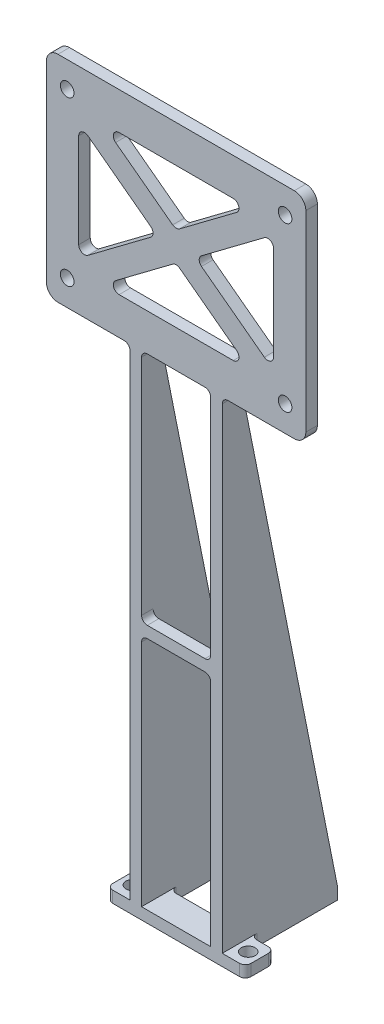
from build123d import *

# Parameters (mm, degrees)
BOSS_EXTRUDE1_DEPTH      = 2.54
CUT_EXTRUDE1_DEPTH       = 2.54
CUT_EXTRUDE3_START       = -2.54
SKETCH4_W                = 57.139047114
SKETCH4_H                = 47.329047114
CUT_EXTRUDE3_DEPTH       = 2.54
FILLET5_R                = 1.27
FILLET6_R                = 1.27
FILLET7_R                = 2.54
BOSS_EXTRUDE2_DEPTH      = 10.16
BOSS_EXTRUDE2_DEPTH_BACK = 10.16
SKETCH7_W                = 15.24
SKETCH7_H                = 106.095476443
CUT_EXTRUDE4_DEPTH       = 52.324
SKETCH8_W                = 15.24
SKETCH8_H                = 12.7
SKETCH8_R                = 1.524
BOSS_EXTRUDE3_DEPTH      = 2.54
SKETCH10_W               = 14.001226512
SKETCH10_H               = 1.640904711
CUT_EXTRUDE5_DEPTH       = 12.192
FILLET9_R                = 1.27
FILLET10_R               = 1.27
SKETCH11_W               = 15.296857303
SKETCH11_H               = 2.54
BOSS_EXTRUDE4_DEPTH      = 2.54
FILLET12_R               = 1.27


with BuildPart() as part:
    # Sketch1 → Boss-Extrude1 (new body)
    with BuildSketch(Plane(origin=(0, 0, 0), x_dir=(-1, 0, 0), z_dir=(0, 0, 1))):
        with BuildLine():
            Line((-27.900000003, -31.869047114), (27.899999998, -31.869047114))
            ThreePointArc((27.899999998, -31.869047114), (30.70654013, -30.706540129), (31.869047114, -27.899999998))
            Line((31.869047114, -27.899999998), (31.869047114, 27.899999996))
            ThreePointArc((31.869047114, 27.899999996), (30.70654013, 30.706540129), (27.899999998, 31.869047114))
            Line((27.899999998, 31.869047114), (-27.899999996, 31.869047114))
            ThreePointArc((-27.899999996, 31.869047114), (-30.706540129, 30.70654013), (-31.869047114, 27.899999998))
            Line((-31.869047114, 27.899999998), (-31.869047114, -27.900000002))
            ThreePointArc((-31.869047114, -27.900000002), (-30.70654013, -30.706540129), (-27.900000003, -31.869047114))
        make_face()
        with BuildLine():
            ThreePointArc((-25.5, 18), (-24, 16.5), (-22.5, 18))
            ThreePointArc((-22.5, 18), (-24, 19.5), (-25.5, 18))
        make_face(mode=Mode.SUBTRACT)
        with BuildLine():
            ThreePointArc((22.5, 18), (24, 16.5), (25.5, 18))
            ThreePointArc((25.5, 18), (24, 19.5), (22.5, 18))
        make_face(mode=Mode.SUBTRACT)
        with BuildLine():
            ThreePointArc((25.5, -18), (24, -16.5), (22.5, -18))
            ThreePointArc((22.5, -18), (24, -19.5), (25.5, -18))
        make_face(mode=Mode.SUBTRACT)
        with BuildLine():
            ThreePointArc((-22.5, -18), (-24, -16.5), (-25.5, -18))
            ThreePointArc((-25.5, -18), (-24, -19.5), (-22.5, -18))
        make_face(mode=Mode.SUBTRACT)
    extrude(amount=BOSS_EXTRUDE1_DEPTH)

    # Sketch2 → Cut-Extrude1 (cut)
    with BuildSketch(Plane.XY.offset(2.54)):
        Polygon((-16.38, 15.46), (0, 3.175), (16.38, 15.46), align=None)
        Polygon((21.46, 12.92), (21.46, -12.92), (4.233333333, 0), align=None)
        Polygon((-21.46, -12.92), (-21.46, 12.92), (-4.233333333, 0), align=None)
        Polygon((0, -3.175), (16.38, -15.46), (-16.38, -15.46), align=None)
    extrude(amount=-CUT_EXTRUDE1_DEPTH, mode=Mode.SUBTRACT)

    # Sketch4 → Cut-Extrude3 (cut)
    with BuildSketch(Plane.XY.offset(2.54).offset(CUT_EXTRUDE3_START)):
        with BuildLine():
            Line((27.900000003, 31.869047114), (-27.899999998, 31.869047114))
            ThreePointArc((-27.899999998, 31.869047114), (-30.70654013, 30.706540129), (-31.869047114, 27.899999998))
            Line((-31.869047114, 27.899999998), (-31.869047114, -27.899999996))
            ThreePointArc((-31.869047114, -27.899999996), (-30.70654013, -30.706540129), (-27.899999998, -31.869047114))
            Line((-27.899999998, -31.869047114), (27.899999996, -31.869047114))
            ThreePointArc((27.899999996, -31.869047114), (30.706540129, -30.70654013), (31.869047114, -27.899999998))
            Line((31.869047114, -27.899999998), (31.869047114, 27.900000002))
            ThreePointArc((31.869047114, 27.900000002), (30.70654013, 30.706540129), (27.900000003, 31.869047114))
        make_face()
        Rectangle(SKETCH4_W, SKETCH4_H, mode=Mode.SUBTRACT)
    extrude(amount=CUT_EXTRUDE3_DEPTH, mode=Mode.SUBTRACT)

    # Fillet5
    fillet5_edges = [part.edges().sort_by_distance(p)[0] for p in [
        (16.38, 15.46, 1.27),
        (-16.38, 15.46, 1.27),
        (-21.46, 12.92, 1.27),
        (-21.46, -12.92, 1.27),
        (16.38, -15.46, 1.27),
        (-16.38, -15.46, 1.27),
        (21.46, 12.92, 1.27),
        (21.46, -12.92, 1.27),
    ]]
    fillet(fillet5_edges, radius=FILLET5_R)

    # Fillet6
    fillet6_edges = [part.edges().sort_by_distance(p)[0] for p in [
        (0, 3.175, 1.27),
        (-4.233333333, 0, 1.27),
        (0, -3.175, 1.27),
        (4.233333333, 0, 1.27),
    ]]
    fillet(fillet6_edges, radius=FILLET6_R)

    # Fillet7
    fillet7_edges = [part.edges().sort_by_distance(p)[0] for p in [
        (28.569523557, -23.664523557, 1.27),
        (-28.569523557, -23.664523557, 1.27),
        (-28.569523557, 23.664523557, 1.27),
        (28.569523557, 23.664523557, 1.27),
    ]]
    fillet(fillet7_edges, radius=FILLET7_R)

    # Sketch6 → Boss-Extrude2 (add, two sides: drawn at the far end of the back side and taken through both)
    with BuildSketch(Plane(origin=(0, 0, 0), x_dir=(0, 0, -1), z_dir=(1, 0, 0)).offset(-BOSS_EXTRUDE2_DEPTH_BACK)):
        Polygon((-2.54, -129.76), (-2.54, -23.664523557), (-2.54, -15.46), (0, -15.46), (22.86, -129.76), align=None)
    extrude(amount=BOSS_EXTRUDE2_DEPTH + BOSS_EXTRUDE2_DEPTH_BACK)

    # Sketch7 → Cut-Extrude4 (cut)
    with BuildSketch(Plane.XY.offset(2.54)):
        with Locations((0, -76.712261779)):
            Rectangle(SKETCH7_W, SKETCH7_H)
    extrude(amount=-CUT_EXTRUDE4_DEPTH, mode=Mode.SUBTRACT)

    # Sketch8 → Boss-Extrude3 (add)
    with BuildSketch(Plane.XZ.offset(129.76)):
        Polygon((-15.24, 2.54), (-15.24, -3.81), (-10.16, -3.81), (-10.16, -22.86), (10.16, -22.86), (10.16, -3.81), (15.24, -3.81), (15.24, 2.54), align=None)
        with Locations((0, -10.16)):
            Rectangle(SKETCH8_W, SKETCH8_H, mode=Mode.SUBTRACT)
        with Locations(Location((-12.7, -0.635, 0), (0, 0, 270))):
            Circle(SKETCH8_R, mode=Mode.SUBTRACT)
        with Locations(Location((12.7, -0.635, 0), (0, 0, 270))):
            Circle(SKETCH8_R, mode=Mode.SUBTRACT)
        with Locations(Location((0, -19.685, 0), (0, 0, 270))):
            Circle(SKETCH8_R, mode=Mode.SUBTRACT)
    extrude(amount=BOSS_EXTRUDE3_DEPTH)

    # Sketch10 → Cut-Extrude5 (cut)
    with BuildSketch(Plane.XZ.offset(23.664523557)):
        with Locations((0.619386744, -0.820452356)):
            Rectangle(SKETCH10_W, SKETCH10_H)
    extrude(amount=-CUT_EXTRUDE5_DEPTH, mode=Mode.SUBTRACT)

    # Fillet9
    fillet9_edges = [part.edges().sort_by_distance(p)[0] for p in [
        (7.62, -23.664523557, 1.27),
        (-7.62, -23.664523557, 0.449547644),
        (-10.16, -23.664523557, 1.27),
        (10.16, -23.664523557, 1.27),
    ]]
    fillet(fillet9_edges, radius=FILLET9_R)

    # Fillet10
    fillet10_edges = [part.edges().sort_by_distance(p)[0] for p in [
        (7.62, -131.03, -3.81),
        (7.62, -131.03, -16.51),
        (-7.62, -131.03, -16.51),
        (10.16, -131.03, -3.81),
        (15.24, -131.03, -3.81),
        (15.24, -131.03, 2.54),
        (-15.24, -131.03, 2.54),
        (-15.24, -131.03, -3.81),
        (-7.62, -131.03, -3.81),
        (-10.16, -131.03, -3.81),
    ]]
    fillet(fillet10_edges, radius=FILLET10_R)

    # Sketch11 → Boss-Extrude4 (add)
    with BuildSketch(Plane.XY.offset(2.54)):
        with Locations((-0.028428652, -76.712261779)):
            Rectangle(SKETCH11_W, SKETCH11_H)
    extrude(amount=-BOSS_EXTRUDE4_DEPTH)

    # Fillet12
    fillet12_edges = [part.edges().sort_by_distance(p)[0] for p in [
        (-7.62, -75.442261779, 1.27),
        (-7.62, -77.982261779, 1.27),
        (7.62, -77.982261779, 1.27),
        (7.62, -75.442261779, 1.27),
    ]]
    fillet(fillet12_edges, radius=FILLET12_R)


solid = part.part
